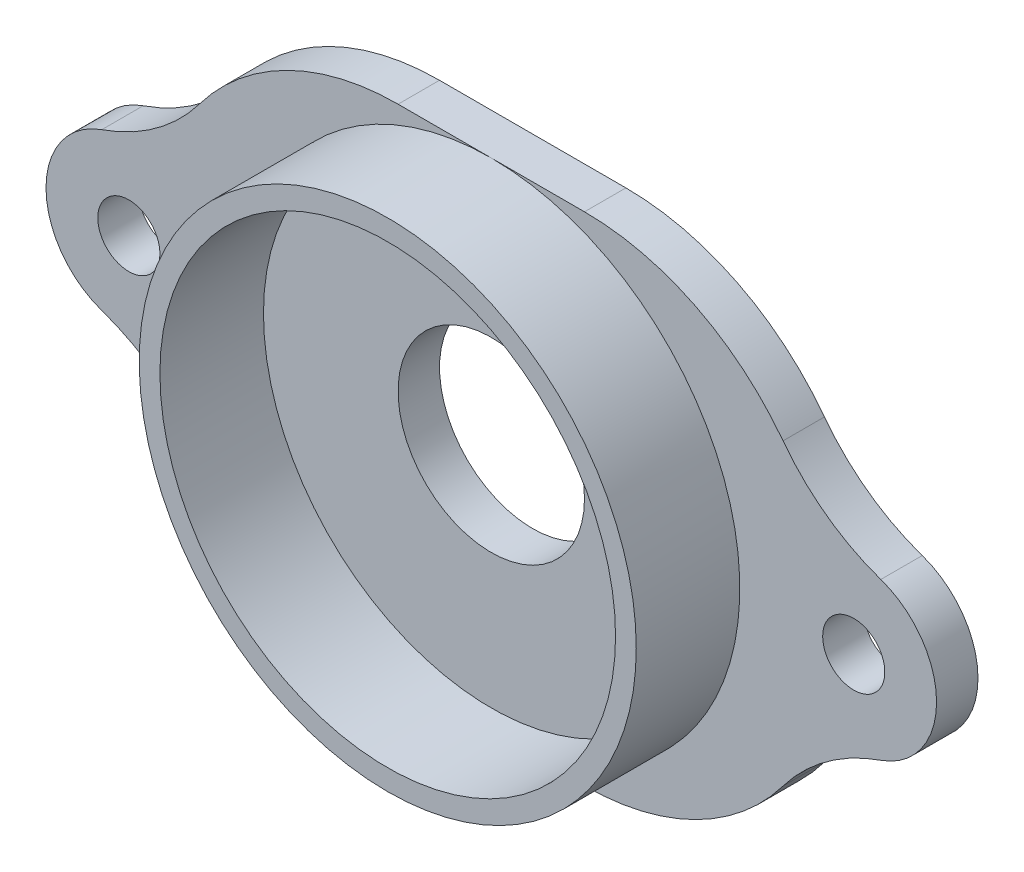
from build123d import *

# Parameters (mm, degrees)
EXTRUDE_2_DEPTH     = 1
SKETCH_3_R          = 12
SKETCH_3_R_2        = 11
EXTRUDE_3_DEPTH     = 5
SKETCH_4_R          = 4.5
CUT_EXTRUDE_1_DEPTH = 26.124689053
SKETCH_5_R          = 1.5
CUT_EXTRUDE_2_DEPTH = 26.597851472


with BuildPart() as part:
    # 草图2 → 凸台-拉伸2 (new, symmetric)
    with BuildSketch(Plane.XY):
        with BuildLine():
            Line((-4.5, 12), (4.5, 12))
            ThreePointArc((4.5, 12), (9.857189903, 10.7378078), (14.087412587, 7.216752724))
            ThreePointArc((14.087412587, 7.216752724), (16.191153731, 5.146301215), (18.807692308, 3.780203808))
            ThreePointArc((18.807692308, 3.780203808), (21.5, 0), (18.807692308, -3.780203808))
            ThreePointArc((18.807692308, -3.780203808), (16.191153731, -5.146301215), (14.087412587, -7.216752724))
            ThreePointArc((14.087412587, -7.216752724), (9.857189903, -10.7378078), (4.5, -12))
            Line((4.5, -12), (-4.5, -12))
            ThreePointArc((-4.5, -12), (-9.857189903, -10.7378078), (-14.087412587, -7.216752724))
            ThreePointArc((-14.087412587, -7.216752724), (-16.191153731, -5.146301215), (-18.807692308, -3.780203808))
            ThreePointArc((-18.807692308, -3.780203808), (-21.5, 0), (-18.807692308, 3.780203808))
            ThreePointArc((-18.807692308, 3.780203808), (-16.191153731, 5.146301215), (-14.087412587, 7.216752724))
            ThreePointArc((-14.087412587, 7.216752724), (-9.857189903, 10.7378078), (-4.5, 12))
        make_face()
    extrude(amount=EXTRUDE_2_DEPTH, both=True)

    # 草图3 → 凸台-拉伸3 (add)
    with BuildSketch(Plane.XY.offset(1)):
        with Locations(Location((0, 0, 0), (0, 0, 270))):
            Circle(SKETCH_3_R)
        Circle(SKETCH_3_R_2, mode=Mode.SUBTRACT)
    extrude(amount=EXTRUDE_3_DEPTH)

    # 草图4 → 切除-拉伸1 (cut, through all)
    with BuildSketch(Plane.XY.offset(1)):
        Circle(SKETCH_4_R)
    extrude(amount=-CUT_EXTRUDE_1_DEPTH, mode=Mode.SUBTRACT)

    # 草图5 → 切除-拉伸2 (cut, through all)
    with BuildSketch(Plane(origin=(0, 0, -1), x_dir=(-1, 0, 0), z_dir=(0, 0, -1))):
        with Locations((17.5, 0)):
            Circle(SKETCH_5_R)
        with Locations((-17.5, 0)):
            Circle(SKETCH_5_R)
    extrude(amount=-CUT_EXTRUDE_2_DEPTH, mode=Mode.SUBTRACT)


solid = part.part
